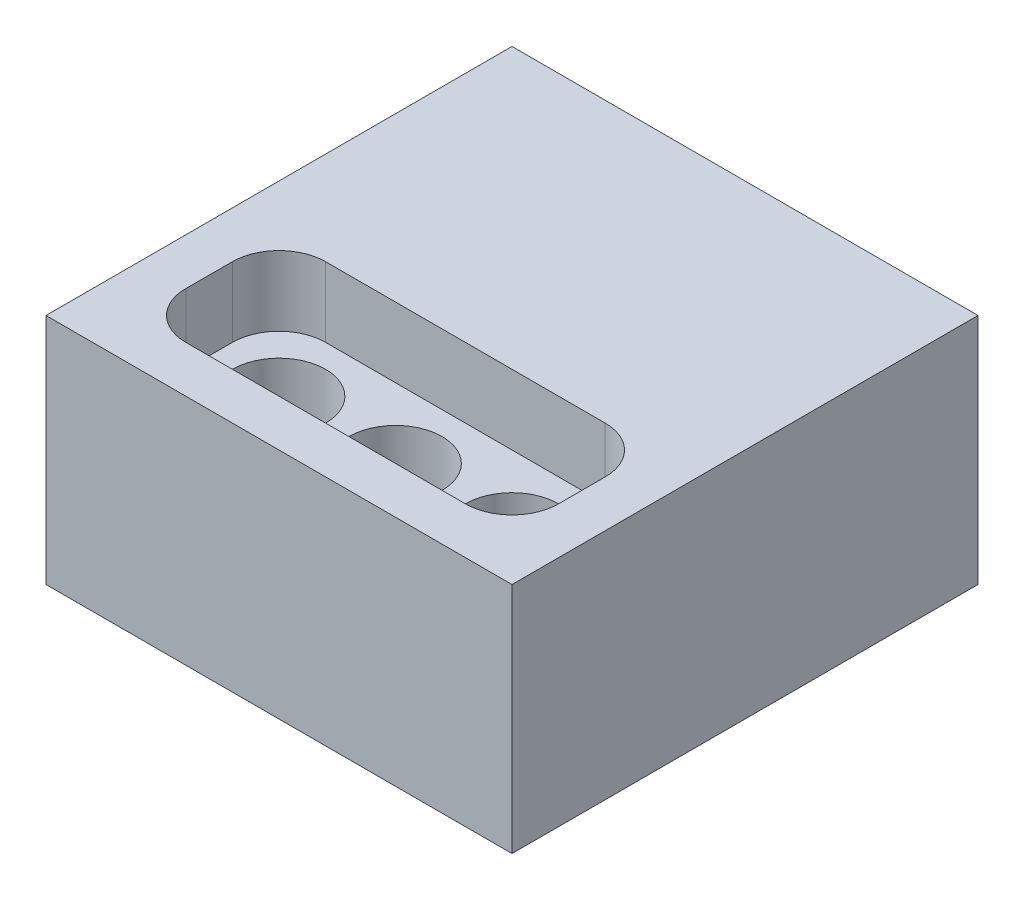
from build123d import *

# Parameters (mm, degrees)
SKETCH1_W           = 100
SKETCH1_H           = 100
BOSS_EXTRUDE1_DEPTH = 50
SKETCH3_W           = 80
SKETCH3_H           = 30
CUT_EXTRUDE2_DEPTH  = 15
FILLET1_R           = 10
SKETCH4_R           = 10
CUT_EXTRUDE3_DEPTH  = 15
SKETCH5_R           = 10
CUT_EXTRUDE4_DEPTH  = 146.688022843


with BuildPart() as part:
    # Sketch1 → Boss-Extrude1 (new body)
    with BuildSketch(Plane(origin=(0, 0, 0), x_dir=(1, 0, 0), z_dir=(0, 1, 0))):
        with Locations((50, 50)):
            Rectangle(SKETCH1_W, SKETCH1_H)
    extrude(amount=BOSS_EXTRUDE1_DEPTH)

    # Sketch3 → Cut-Extrude2 (cut)
    with BuildSketch(Plane(origin=(0, 50, 0), x_dir=(1, 0, 0), z_dir=(0, 1, 0))):
        with Locations((50, 25)):
            Rectangle(SKETCH3_W, SKETCH3_H)
    extrude(amount=-CUT_EXTRUDE2_DEPTH, mode=Mode.SUBTRACT)

    # Fillet1
    fillet1_edges = [part.edges().sort_by_distance(p)[0] for p in [
        (10, 42.5, -10),
        (10, 42.5, -40),
        (90, 42.5, -40),
        (90, 42.5, -10),
    ]]
    fillet(fillet1_edges, radius=FILLET1_R)

    # Sketch4 → Cut-Extrude3 (cut)
    with BuildSketch(Plane(origin=(0, 35, 0), x_dir=(1, 0, 0), z_dir=(0, 1, 0))):
        with Locations(Location((25, 25, 0), (0, 0, 270))):
            Circle(SKETCH4_R)
        with Locations(Location((75, 25, 0), (0, 0, 270))):
            Circle(SKETCH4_R)
    extrude(amount=-CUT_EXTRUDE3_DEPTH, mode=Mode.SUBTRACT)

    # Sketch5 → Cut-Extrude4 (cut, through all)
    with BuildSketch(Plane(origin=(0, 35, 0), x_dir=(1, 0, 0), z_dir=(0, 1, 0))):
        with Locations(Location((50, 25, 0), (0, 0, 270))):
            Circle(SKETCH5_R)
    extrude(amount=-CUT_EXTRUDE4_DEPTH, mode=Mode.SUBTRACT)


solid = part.part
